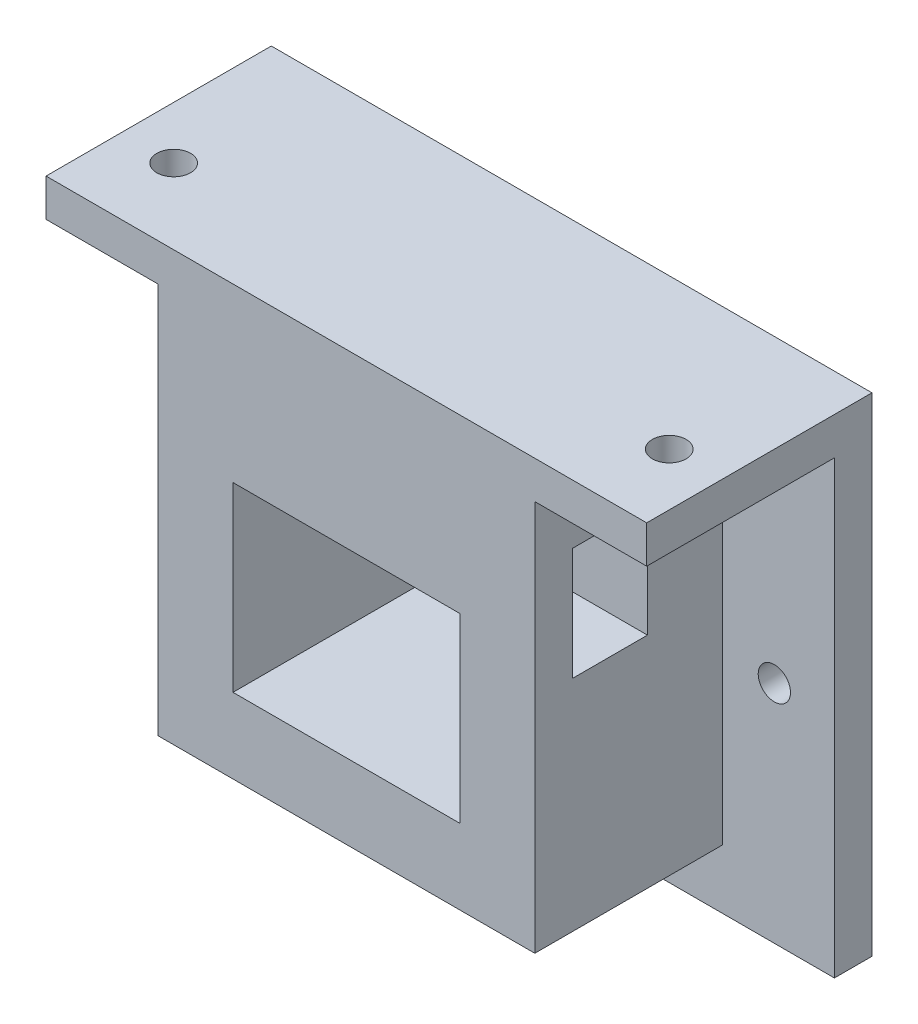
from build123d import *

# Parameters (mm, degrees)
SKETCH1_W               = 80
SKETCH1_H               = 60
BOSS_EXTRUDE1_DEPTH     = 5
SKETCH2_W               = 50.2
SKETCH2_H               = 44.2
SKETCH2_W_2             = 30.2
SKETCH2_H_2             = 24.2
BOSS_EXTRUDE2_DEPTH     = 25
CUT_EXTRUDE1_DEPTH      = 87.810195254
CUT_EXTRUDE1_DEPTH_BACK = 87.810195254
SKETCH3_W               = 10
SKETCH3_H               = 15
SKETCH4_W               = 50.2
SKETCH4_H               = 7.9
BOSS_EXTRUDE3_DEPTH     = 25
CHAMFER1_SIZE           = 7.7
SKETCH5_W               = 14.9
SKETCH5_H               = 25
BOSS_EXTRUDE4_DEPTH     = 5
SKETCH6_R               = 2.25
CUT_EXTRUDE3_DEPTH      = 5
CUT_EXTRUDE4_DEPTH      = 107.066017178
CUT_EXTRUDE4_DEPTH_BACK = 107.066017178
SKETCH7_R               = 2.15


with BuildPart() as part:
    # Sketch1 → Boss-Extrude1 (new body)
    with BuildSketch(Plane.XY):
        with Locations((40, 30)):
            Rectangle(SKETCH1_W, SKETCH1_H)
    extrude(amount=BOSS_EXTRUDE1_DEPTH)

    # Sketch2 → Boss-Extrude2 (add)
    with BuildSketch(Plane.XY.offset(5)):
        with Locations((40, 30)):
            Rectangle(SKETCH2_W, SKETCH2_H)
        with Locations((40, 30)):
            Rectangle(SKETCH2_W_2, SKETCH2_H_2, mode=Mode.SUBTRACT)
    extrude(amount=BOSS_EXTRUDE2_DEPTH)

    # Sketch3 → Cut-Extrude1 (cut, two sides: drawn at the far end of the back side and taken through both)
    with BuildSketch(Plane.ZY.offset(-55.1).offset(-CUT_EXTRUDE1_DEPTH_BACK)):
        with Locations((20, 44.6)):
            Rectangle(SKETCH3_W, SKETCH3_H)
    extrude(amount=CUT_EXTRUDE1_DEPTH + CUT_EXTRUDE1_DEPTH_BACK, mode=Mode.SUBTRACT)

    # Sketch4 → Boss-Extrude3 (add)
    with BuildSketch(Plane.XY.offset(5)):
        with Locations((40, 56.05)):
            Rectangle(SKETCH4_W, SKETCH4_H)
    extrude(amount=BOSS_EXTRUDE3_DEPTH)

    # Chamfer1
    chamfer1_edges = [part.edges().sort_by_distance(p)[0] for p in [
        (40, 42.1, 5),
    ]]
    chamfer(chamfer1_edges, length=CHAMFER1_SIZE)

    # Sketch5 → Boss-Extrude4 (add)
    with BuildSketch(Plane(origin=(0, 60, 0), x_dir=(1, 0, 0), z_dir=(0, 1, 0))):
        with Locations((7.45, -17.5)):
            Rectangle(SKETCH5_W, SKETCH5_H)
        Polygon((80, -5), (80, 0), (0, 0), (0, -5), (14.9, -5), (14.9, -30), (65.1, -30), (65.1, -5), align=None)
        with Locations((72.55, -17.5)):
            Rectangle(SKETCH5_W, SKETCH5_H)
    extrude(amount=BOSS_EXTRUDE4_DEPTH)

    # Sketch6 → Cut-Extrude3 (cut)
    with BuildSketch(Plane.XZ.offset(-60)):
        with Locations(Location((7, 20, 0), (0, 0, 270))):
            Circle(SKETCH6_R)
    cut_extrude3 = extrude(amount=-CUT_EXTRUDE3_DEPTH, mode=Mode.SUBTRACT)

    # Mirror1: Cut-Extrude3 across plane
    add(cut_extrude3.mirror(Plane.ZY.offset(-40)), mode=Mode.SUBTRACT)

    # Sketch7 → Cut-Extrude4 (cut, two sides: drawn at the far end of the back side and taken through both)
    with BuildSketch(Plane.XY.offset(5).offset(-CUT_EXTRUDE4_DEPTH_BACK)):
        with Locations((8, 30)):
            Circle(SKETCH7_R)
        with Locations(Location((72, 30, 0), (0, 0, 180))):
            Circle(SKETCH7_R)
    extrude(amount=CUT_EXTRUDE4_DEPTH + CUT_EXTRUDE4_DEPTH_BACK, mode=Mode.SUBTRACT)


solid = part.part
